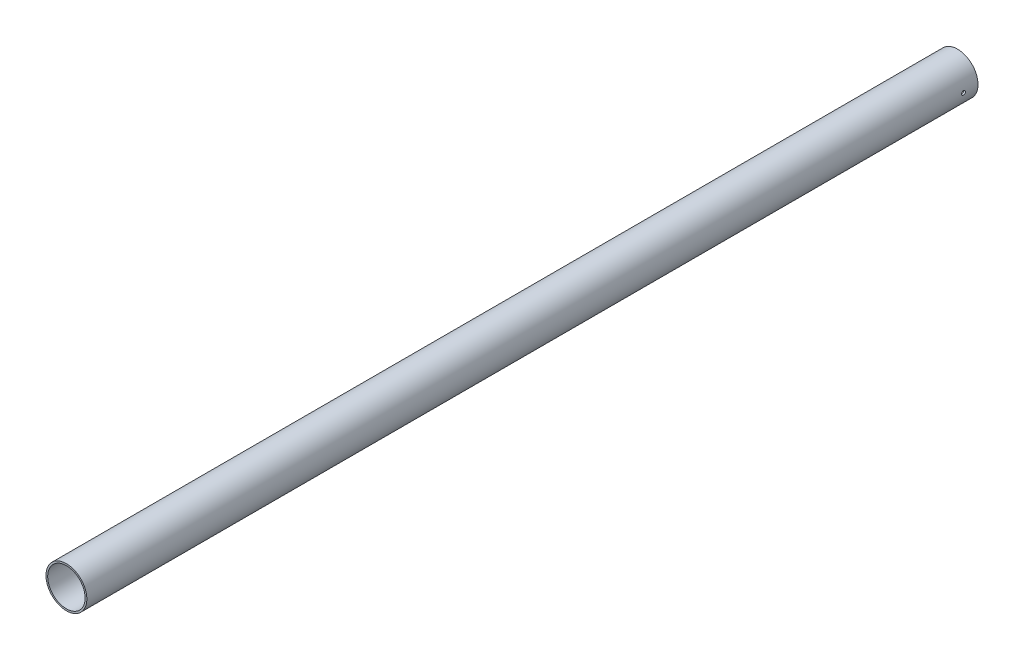
from build123d import *

# Parameters (mm, degrees)
SKETCH1_R           = 12.7
SKETCH1_R_2         = 11.6205
BOSS_EXTRUDE1_DEPTH = 553.63
SKETCH3_W           = 1.2
SKETCH3_H           = 12.7


with BuildPart() as part:
    # Sketch1 → Boss-Extrude1 (new body)
    with BuildSketch(Plane.XY):
        Circle(SKETCH1_R)
        Circle(SKETCH1_R_2, mode=Mode.SUBTRACT)
    extrude(amount=BOSS_EXTRUDE1_DEPTH)

    # Sketch3 → M2 Clearance Hole1 (revolve, cut)
    with BuildSketch(Plane(origin=(0, 0, 9), x_dir=(0, 0, 1), z_dir=(0, 1, 0))):
        with Locations((0.6, 6.35)):
            Rectangle(SKETCH3_W, SKETCH3_H)
    m2_clearance_hole1 = revolve(axis=Axis((-6.35, 0, 9), (1, 0, 0)), mode=Mode.SUBTRACT)

    # Mirror1: M2 Clearance Hole1 across plane
    add(m2_clearance_hole1.mirror(Plane(origin=(0, 0, 0), x_dir=(0, 0, 1), z_dir=(1, 0, 0))), mode=Mode.SUBTRACT)


solid = part.part
